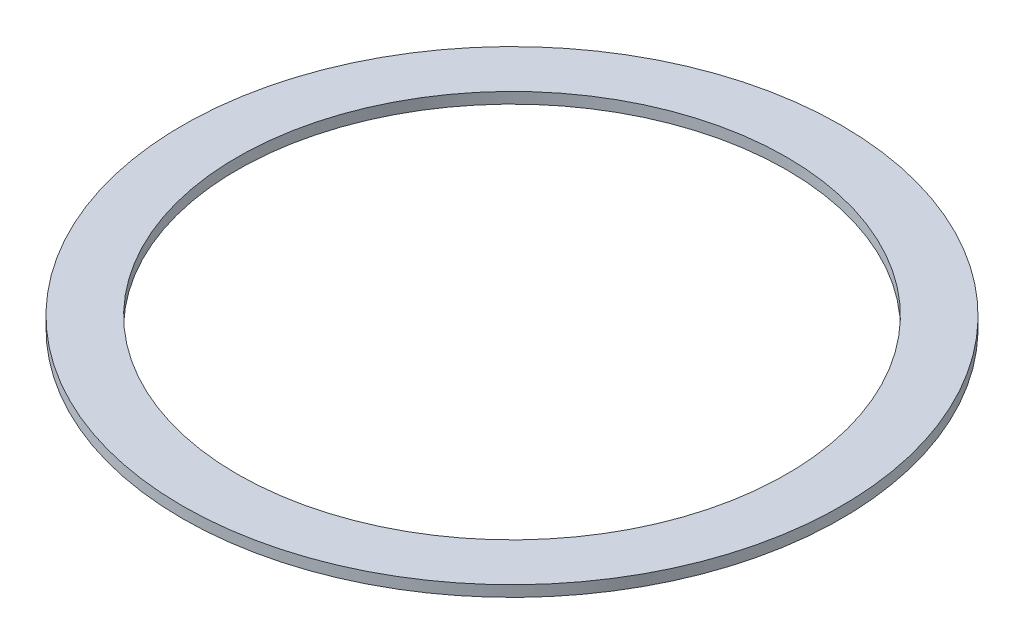
from build123d import *

# Parameters (mm, degrees)
SKETCH_1_W = 10
SKETCH_1_H = 2


with BuildPart() as part:
    # Эскиз1 → Повернуть1 (revolve)
    with BuildSketch(Plane.XY):
        with Locations((55, 0)):
            Rectangle(SKETCH_1_W, SKETCH_1_H)
    revolve(axis=Axis((0, 131.034482759, 0), (0, -1, 0)))


solid = part.part
